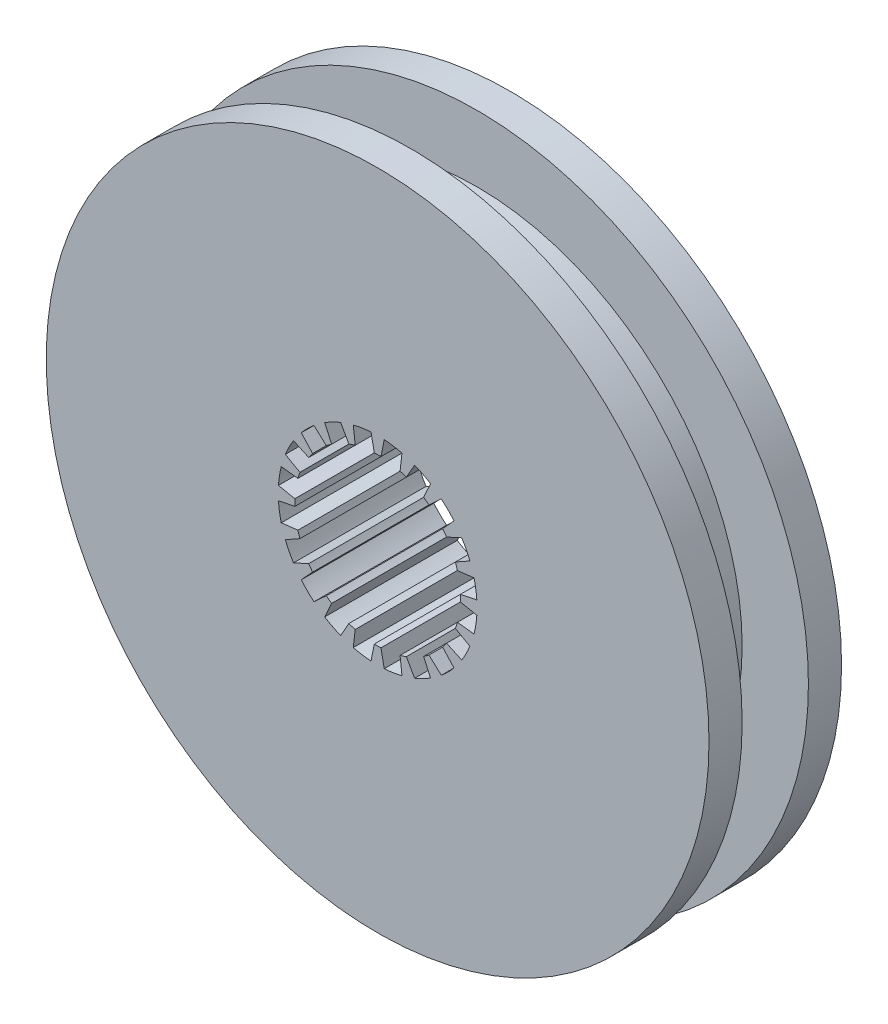
from build123d import *

# Parameters (mm, degrees)
SKETCH1_R           = 50
BOSS_EXTRUDE1_DEPTH = 10
SKETCH2_W           = 10
SKETCH2_H           = 10


with BuildPart() as part:
    # Sketch1 → Boss-Extrude1 (new, symmetric)
    with BuildSketch(Plane.XY):
        Circle(SKETCH1_R)
        with BuildLine():
            Line((-1, 14.966629547), (-0.5, 12.489995997))
            ThreePointArc((-0.5, 12.489995997), (0, 12.5), (0.5, 12.489995997))
            Line((0.5, 12.489995997), (1, 14.966629547))
            ThreePointArc((1, 14.966629547), (2.346516976, 14.815325109), (3.673886362, 14.543127552))
            Line((3.673886362, 14.543127552), (3.384092765, 12.033200578))
            ThreePointArc((3.384092765, 12.033200578), (3.86271243, 11.888206454), (4.335149281, 11.724183584))
            Line((4.335149281, 11.724183584), (5.575999395, 13.925093563))
            ThreePointArc((5.575999395, 13.925093563), (6.809857496, 13.365097863), (7.98814713, 12.696042904))
            Line((7.98814713, 12.696042904), (6.936926951, 10.398511647))
            ThreePointArc((6.936926951, 10.398511647), (7.347315654, 10.11271243), (7.745943945, 9.810726395))
            Line((7.745943945, 9.810726395), (9.606181119, 11.5204724))
            ThreePointArc((9.606181119, 11.5204724), (10.606601718, 10.606601718), (11.5204724, 9.606181119))
            Line((11.5204724, 9.606181119), (9.810726395, 7.745943945))
            ThreePointArc((9.810726395, 7.745943945), (10.11271243, 7.347315654), (10.398511647, 6.936926951))
            Line((10.398511647, 6.936926951), (12.696042904, 7.98814713))
            ThreePointArc((12.696042904, 7.98814713), (13.365097863, 6.809857496), (13.925093563, 5.575999395))
            Line((13.925093563, 5.575999395), (11.724183584, 4.335149281))
            ThreePointArc((11.724183584, 4.335149281), (11.888206454, 3.86271243), (12.033200578, 3.384092765))
            Line((12.033200578, 3.384092765), (14.543127552, 3.673886362))
            ThreePointArc((14.543127552, 3.673886362), (14.815325109, 2.346516976), (14.966629547, 1))
            Line((14.966629547, 1), (12.489995997, 0.5))
            ThreePointArc((12.489995997, 0.5), (12.5, 0), (12.489995997, -0.5))
            Line((12.489995997, -0.5), (14.966629547, -1))
            ThreePointArc((14.966629547, -1), (14.815325109, -2.346516976), (14.543127552, -3.673886362))
            Line((14.543127552, -3.673886362), (12.033200578, -3.384092765))
            ThreePointArc((12.033200578, -3.384092765), (11.888206454, -3.86271243), (11.724183584, -4.335149281))
            Line((11.724183584, -4.335149281), (13.925093563, -5.575999395))
            ThreePointArc((13.925093563, -5.575999395), (13.365097863, -6.809857496), (12.696042904, -7.98814713))
            Line((12.696042904, -7.98814713), (10.398511647, -6.936926951))
            ThreePointArc((10.398511647, -6.936926951), (10.11271243, -7.347315654), (9.810726395, -7.745943945))
            Line((9.810726395, -7.745943945), (11.5204724, -9.606181119))
            ThreePointArc((11.5204724, -9.606181119), (10.606601718, -10.606601718), (9.606181119, -11.5204724))
            Line((9.606181119, -11.5204724), (7.745943945, -9.810726395))
            ThreePointArc((7.745943945, -9.810726395), (7.347315654, -10.11271243), (6.936926951, -10.398511647))
            Line((6.936926951, -10.398511647), (7.98814713, -12.696042904))
            ThreePointArc((7.98814713, -12.696042904), (6.809857496, -13.365097863), (5.575999395, -13.925093563))
            Line((5.575999395, -13.925093563), (4.335149281, -11.724183584))
            ThreePointArc((4.335149281, -11.724183584), (3.86271243, -11.888206454), (3.384092765, -12.033200578))
            Line((3.384092765, -12.033200578), (3.673886362, -14.543127552))
            ThreePointArc((3.673886362, -14.543127552), (2.346516976, -14.815325109), (1, -14.966629547))
            Line((1, -14.966629547), (0.5, -12.489995997))
            ThreePointArc((0.5, -12.489995997), (0, -12.5), (-0.5, -12.489995997))
            Line((-0.5, -12.489995997), (-1, -14.966629547))
            ThreePointArc((-1, -14.966629547), (-2.346516976, -14.815325109), (-3.673886362, -14.543127552))
            Line((-3.673886362, -14.543127552), (-3.384092765, -12.033200578))
            ThreePointArc((-3.384092765, -12.033200578), (-3.86271243, -11.888206454), (-4.335149281, -11.724183584))
            Line((-4.335149281, -11.724183584), (-5.575999395, -13.925093563))
            ThreePointArc((-5.575999395, -13.925093563), (-6.809857496, -13.365097863), (-7.98814713, -12.696042904))
            Line((-7.98814713, -12.696042904), (-6.936926951, -10.398511647))
            ThreePointArc((-6.936926951, -10.398511647), (-7.347315654, -10.11271243), (-7.745943945, -9.810726395))
            Line((-7.745943945, -9.810726395), (-9.606181119, -11.5204724))
            ThreePointArc((-9.606181119, -11.5204724), (-10.606601718, -10.606601718), (-11.5204724, -9.606181119))
            Line((-11.5204724, -9.606181119), (-9.810726395, -7.745943945))
            ThreePointArc((-9.810726395, -7.745943945), (-10.11271243, -7.347315654), (-10.398511647, -6.936926951))
            Line((-10.398511647, -6.936926951), (-12.696042904, -7.98814713))
            ThreePointArc((-12.696042904, -7.98814713), (-13.365097863, -6.809857496), (-13.925093563, -5.575999395))
            Line((-13.925093563, -5.575999395), (-11.724183584, -4.335149281))
            ThreePointArc((-11.724183584, -4.335149281), (-11.888206454, -3.86271243), (-12.033200578, -3.384092765))
            Line((-12.033200578, -3.384092765), (-14.543127552, -3.673886362))
            ThreePointArc((-14.543127552, -3.673886362), (-14.815325109, -2.346516976), (-14.966629547, -1))
            Line((-14.966629547, -1), (-12.489995997, -0.5))
            ThreePointArc((-12.489995997, -0.5), (-12.5, 0), (-12.489995997, 0.5))
            Line((-12.489995997, 0.5), (-14.966629547, 1))
            ThreePointArc((-14.966629547, 1), (-14.815325109, 2.346516976), (-14.543127552, 3.673886362))
            Line((-14.543127552, 3.673886362), (-12.033200578, 3.384092765))
            ThreePointArc((-12.033200578, 3.384092765), (-11.888206454, 3.86271243), (-11.724183584, 4.335149281))
            Line((-11.724183584, 4.335149281), (-13.925093563, 5.575999395))
            ThreePointArc((-13.925093563, 5.575999395), (-13.365097863, 6.809857496), (-12.696042904, 7.98814713))
            Line((-12.696042904, 7.98814713), (-10.398511647, 6.936926951))
            ThreePointArc((-10.398511647, 6.936926951), (-10.11271243, 7.347315654), (-9.810726395, 7.745943945))
            Line((-9.810726395, 7.745943945), (-11.5204724, 9.606181119))
            ThreePointArc((-11.5204724, 9.606181119), (-10.606601718, 10.606601718), (-9.606181119, 11.5204724))
            Line((-9.606181119, 11.5204724), (-7.745943945, 9.810726395))
            ThreePointArc((-7.745943945, 9.810726395), (-7.347315654, 10.11271243), (-6.936926951, 10.398511647))
            Line((-6.936926951, 10.398511647), (-7.98814713, 12.696042904))
            ThreePointArc((-7.98814713, 12.696042904), (-6.809857496, 13.365097863), (-5.575999395, 13.925093563))
            Line((-5.575999395, 13.925093563), (-4.335149281, 11.724183584))
            ThreePointArc((-4.335149281, 11.724183584), (-3.86271243, 11.888206454), (-3.384092765, 12.033200578))
            Line((-3.384092765, 12.033200578), (-3.673886362, 14.543127552))
            ThreePointArc((-3.673886362, 14.543127552), (-2.346516976, 14.815325109), (-1, 14.966629547))
        make_face(mode=Mode.SUBTRACT)
    extrude(amount=BOSS_EXTRUDE1_DEPTH, both=True)

    # Sketch2 → Cut-Revolve1 (revolve, cut)
    with BuildSketch(Plane(origin=(0, 0, 0), x_dir=(0, 0, -1), z_dir=(1, 0, 0)), mode=Mode.PRIVATE) as cut_revolve1_sk:
        with Locations((0, 45)):
            Rectangle(SKETCH2_W, SKETCH2_H)
    revolve(cut_revolve1_sk.sketch.rotate(Axis((0, 0, 1000), (0, 0, -1)), 90), axis=Axis((0, 0, 1000), (0, 0, -1)), mode=Mode.SUBTRACT)


solid = part.part
